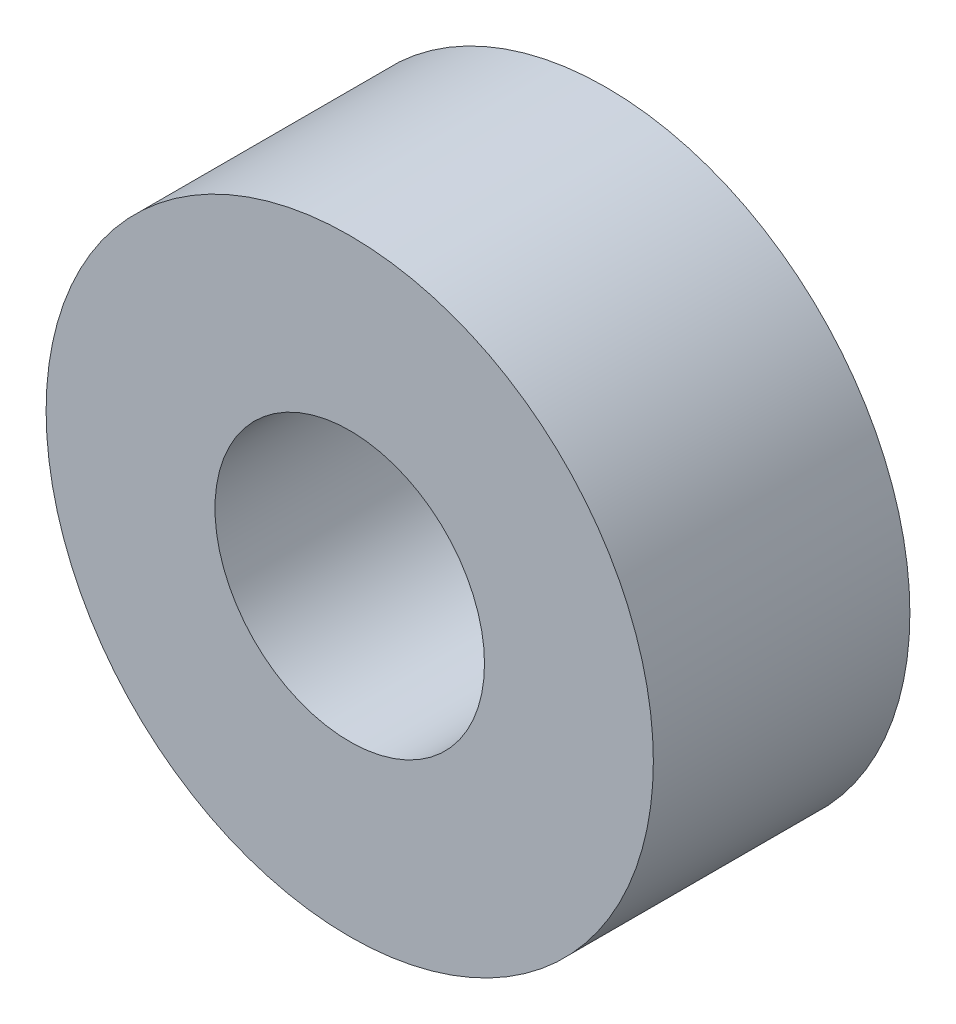
from build123d import *

# Parameters (mm, degrees)
SKETCH1_R           = 9.35
SKETCH1_R_2         = 4.15
BOSS_EXTRUDE1_DEPTH = 7.9


with BuildPart() as part:
    # Sketch1 → Boss-Extrude1 (new body)
    with BuildSketch(Plane.XY):
        Circle(SKETCH1_R)
        Circle(SKETCH1_R_2, mode=Mode.SUBTRACT)
    extrude(amount=BOSS_EXTRUDE1_DEPTH)


solid = part.part
